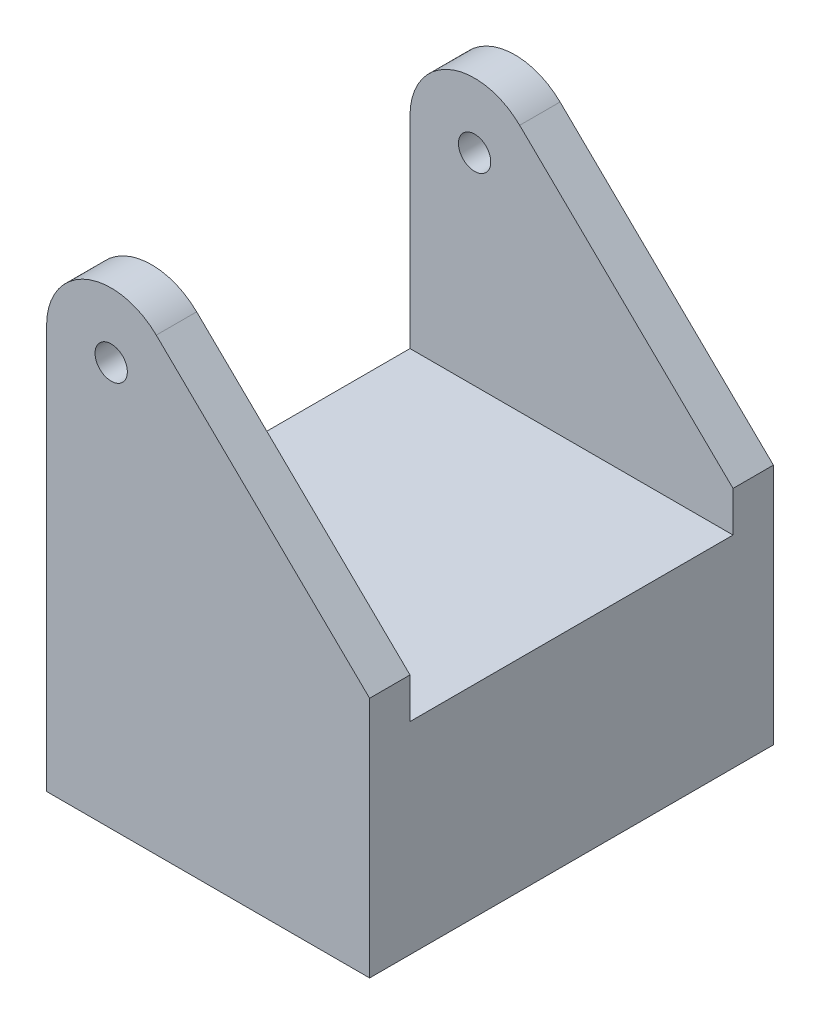
from build123d import *

# Parameters (mm, degrees)
SALIENTE_EXTRUIR3_DEPTH = 250
CROQUIS6_R              = 10
CORTAR_EXTRUIR1_DEPTH   = 264
CROQUIS7_W              = 200
CROQUIS7_H              = 165
CORTAR_EXTRUIR3_DEPTH   = 264


with BuildPart() as part:
    # Croquis3 → Saliente-Extruir3 (new body)
    with BuildSketch(Plane.XY):
        with BuildLine():
            Line((200, 150), (67.909088668, 278.654541869))
            ThreePointArc((67.909088668, 278.654541869), (24.449494329, 286.853517788), (0, 250))
            Line((0, 250), (0, 150))
            Line((0, 150), (0, 0))
            Line((0, 0), (200, 0))
            Line((200, 0), (200, 150))
        make_face()
    extrude(amount=SALIENTE_EXTRUIR3_DEPTH)

    # Croquis6 → Cortar-Extruir1 (cut)
    with BuildSketch(Plane(origin=(0, 0, 0), x_dir=(-1, 0, 0), z_dir=(0, 0, -1))):
        with Locations((-40, 250)):
            Circle(CROQUIS6_R)
    extrude(amount=-CORTAR_EXTRUIR1_DEPTH, mode=Mode.SUBTRACT)

    # Croquis7 → Cortar-Extruir3 (cut)
    with BuildSketch(Plane.ZY):
        with Locations((125, 207.5)):
            Rectangle(CROQUIS7_W, CROQUIS7_H)
    extrude(amount=-CORTAR_EXTRUIR3_DEPTH, mode=Mode.SUBTRACT)


solid = part.part
